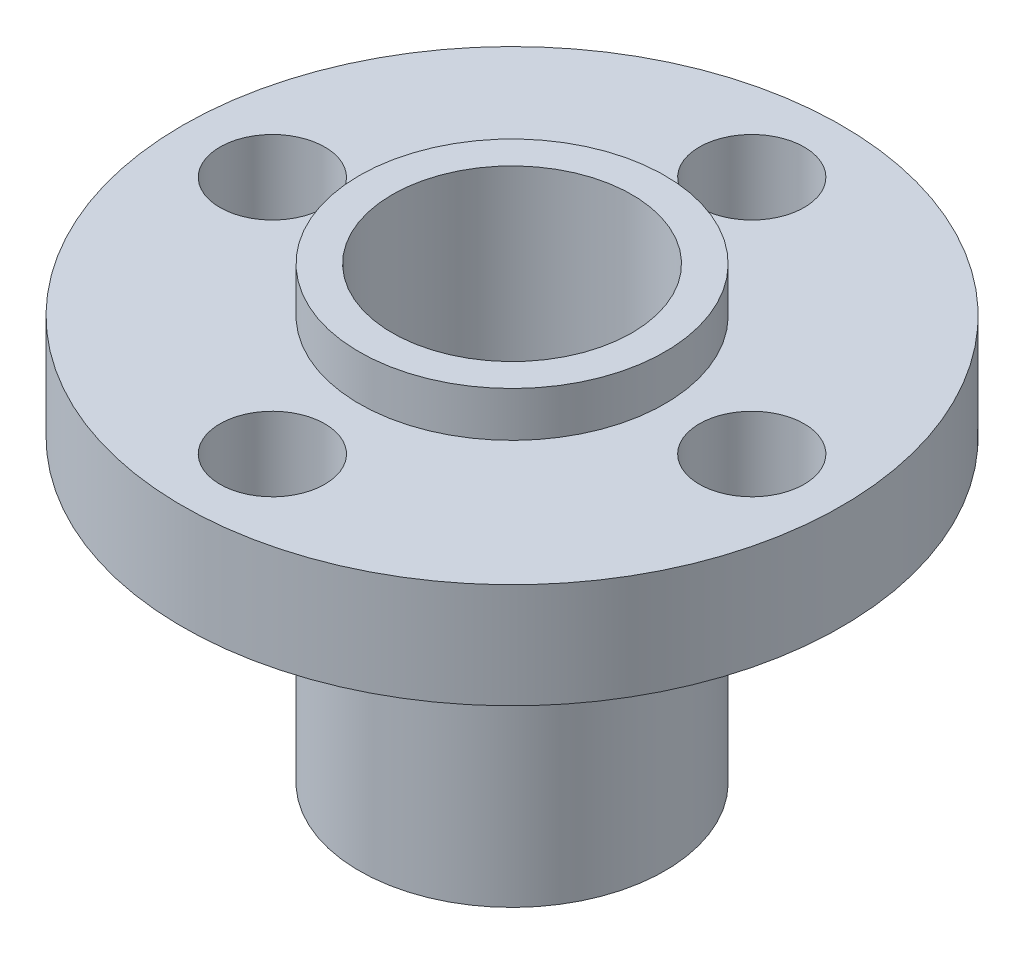
from build123d import *

# Parameters (mm, degrees)
ESBO_O2_R             = 4
CORTE_EXTRUS_O1_DEPTH = 57
ESBO_O3_R             = 1.75
CORTE_EXTRUS_O2_DEPTH = 21.597329924
PADR_OCIRCULAR1_COUNT = 4


with BuildPart() as part:
    # Esboço1 → Revolução1 (revolve)
    with BuildSketch(Plane.XY):
        Polygon((0, 0), (-5.1, 0), (-5.1, 10), (-11, 10), (-11, 13.5), (-5.1, 13.5), (-5.1, 15), (0, 15), (0, 13.5), align=None)
    revolve(axis=Axis((0, 13.5, 0), (0, -1, 0)))

    # Esboço2 → Corte-extrusão1 (cut)
    with BuildSketch(Plane.XZ):
        Circle(ESBO_O2_R)
    extrude(amount=-CORTE_EXTRUS_O1_DEPTH, mode=Mode.SUBTRACT)

    # Esboço3 → Corte-extrusão2 (cut, through all)
    with BuildSketch(Plane(origin=(0, 13.5, 0), x_dir=(1, 0, 0), z_dir=(0, 1, 0))):
        with Locations(Location((0, 8, 0), (0, 0, 180))):
            Circle(ESBO_O3_R)
    corte_extrus_o2 = extrude(amount=-CORTE_EXTRUS_O2_DEPTH, mode=Mode.SUBTRACT)

    # PadrãoCircular1: Corte-extrusão2 ×4 about axis
    padr_ocircular1_axis = Axis((0, 0, 0), (0, 1, 0))
    for i in range(1, PADR_OCIRCULAR1_COUNT):
        add(corte_extrus_o2.rotate(padr_ocircular1_axis, i * 360 / PADR_OCIRCULAR1_COUNT), mode=Mode.SUBTRACT)


solid = part.part
